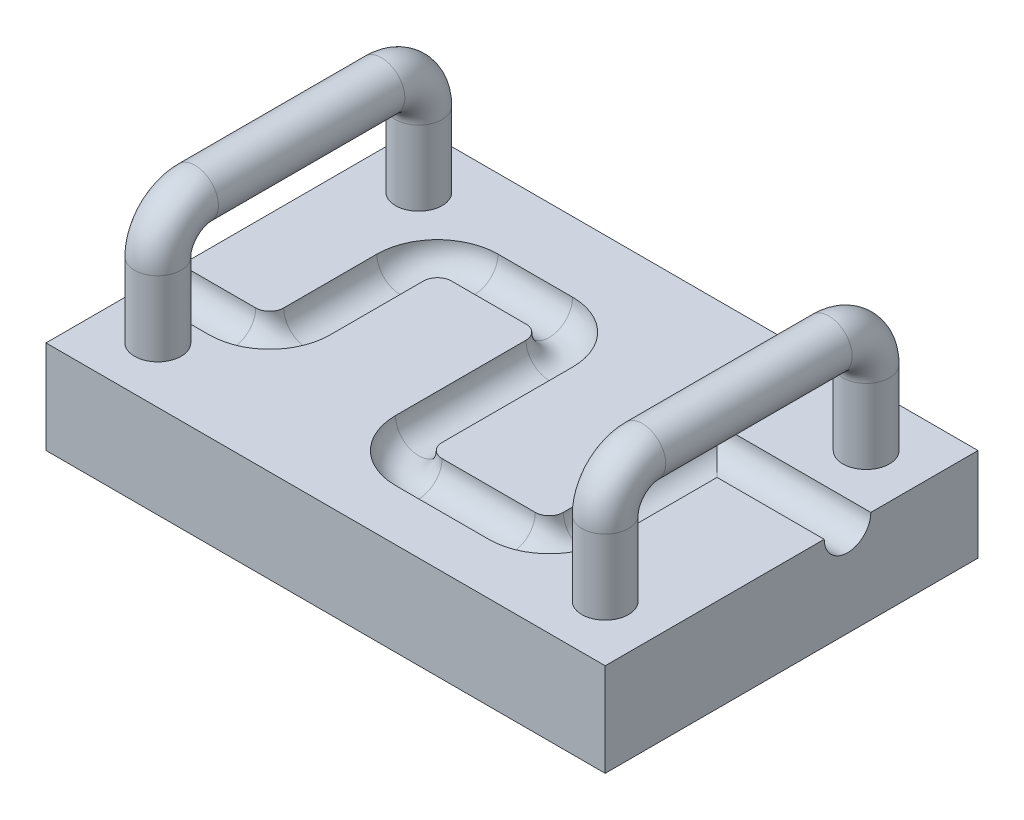
from build123d import *

# Parameters (mm, degrees)
SKETCH1_W            = 300
SKETCH1_H            = 200
BOSS_EXTRUDE1_DEPTH  = 50
CUT_SWEEP1_PROFILE_R = 12.5
SWEEP1_PROFILE_R     = 12.5


with BuildPart() as part:
    # Sketch1 → Boss-Extrude1 (new body)
    with BuildSketch(Plane(origin=(0, 0, 0), x_dir=(1, 0, 0), z_dir=(0, 1, 0))):
        Rectangle(SKETCH1_W, SKETCH1_H)
    extrude(amount=-BOSS_EXTRUDE1_DEPTH)

    # Cut-Sweep1: sweep along a path in Sketch2
    with BuildLine(Plane(origin=(0, 0, 0), x_dir=(1, 0, 0), z_dir=(0, 1, 0))) as cut_sweep1_path:
        Line((-150, -40), (-110, -40))
        ThreePointArc((-110, -40), (-95.857864376, -34.142135624), (-90, -20))
        Line((-90, -20), (-90, 30))
        ThreePointArc((-90, 30), (-84.142135624, 44.142135624), (-70, 50))
        Line((-70, 50), (-30, 50))
        ThreePointArc((-30, 50), (-15.857864376, 44.142135624), (-10, 30))
        Line((-10, 30), (-10, -40))
        ThreePointArc((-10, -40), (-4.142135624, -54.142135624), (10, -60))
        Line((10, -60), (60, -60))
        ThreePointArc((60, -60), (74.142135624, -54.142135624), (80, -40))
        Line((80, -40), (80, 30))
        Line((80, 30), (150, 30))
    # Cut-Sweep1 profile (on start of the path) → Cut-Sweep1 (sweep, cut)
    with BuildSketch(Plane(origin=(-150, 0, 40), x_dir=(0, 0, 1), z_dir=(1, 0, 0))):
        Circle(CUT_SWEEP1_PROFILE_R)
    sweep(path=cut_sweep1_path.line, transition=Transition.RIGHT, mode=Mode.SUBTRACT)

    # Sweep1: sweep along a path in Sketch4
    with BuildLine(Plane.ZY.offset(120)) as sweep1_path:
        Line((-70, 0), (-70, 40))
        ThreePointArc((-70, 40), (-64.142135624, 54.142135624), (-50, 60))
        Line((-50, 60), (50, 60))
        ThreePointArc((50, 60), (64.142135624, 54.142135624), (70, 40))
        Line((70, 40), (70, 0))
    # Sweep1 profile (on start of the path) → Sweep1 (sweep)
    with BuildSketch(Plane(origin=(-120, 0, -70), x_dir=(0, 0, 1), z_dir=(0, 1, 0))):
        Circle(SWEEP1_PROFILE_R)
    sweep1 = sweep(path=sweep1_path.line)

    # Mirror1: Sweep1 across plane
    add(sweep1.mirror(Plane(origin=(0, 0, 0), x_dir=(0, 0, 1), z_dir=(1, 0, 0))))


solid = part.part
